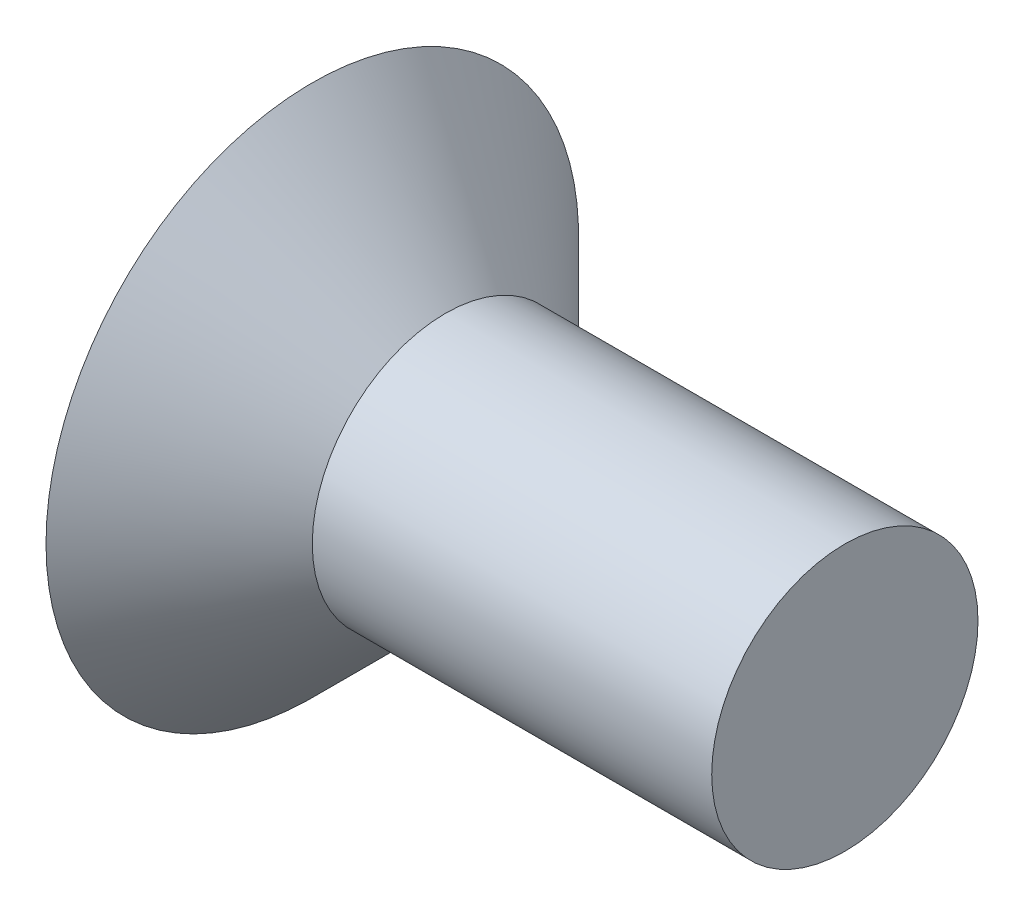
from build123d import *

# Parameters (mm, degrees)
CUT_EXTRUDE_1_DEPTH = 1


with BuildPart() as part:
    # 草图1 → 旋转1 (revolve)
    with BuildSketch(Plane.XY, mode=Mode.PRIVATE) as revolve_1_sk:
        Polygon((0, 0), (0, 3), (1.5, 1.5), (6, 1.5), (6, 0), align=None)
    revolve(revolve_1_sk.sketch.rotate(Axis((0, 0, 0), (1, 0, 0)), 90), axis=Axis((0, 0, 0), (1, 0, 0)))

    # 草图2 → 切除-拉伸1 (cut)
    with BuildSketch(Plane.ZY):
        Polygon((0, 1.154700538), (-1, 0.577350269), (-1, -0.577350269), (0, -1.154700538), (1, -0.577350269), (1, 0.577350269), align=None)
    extrude(amount=-CUT_EXTRUDE_1_DEPTH, mode=Mode.SUBTRACT)


solid = part.part
